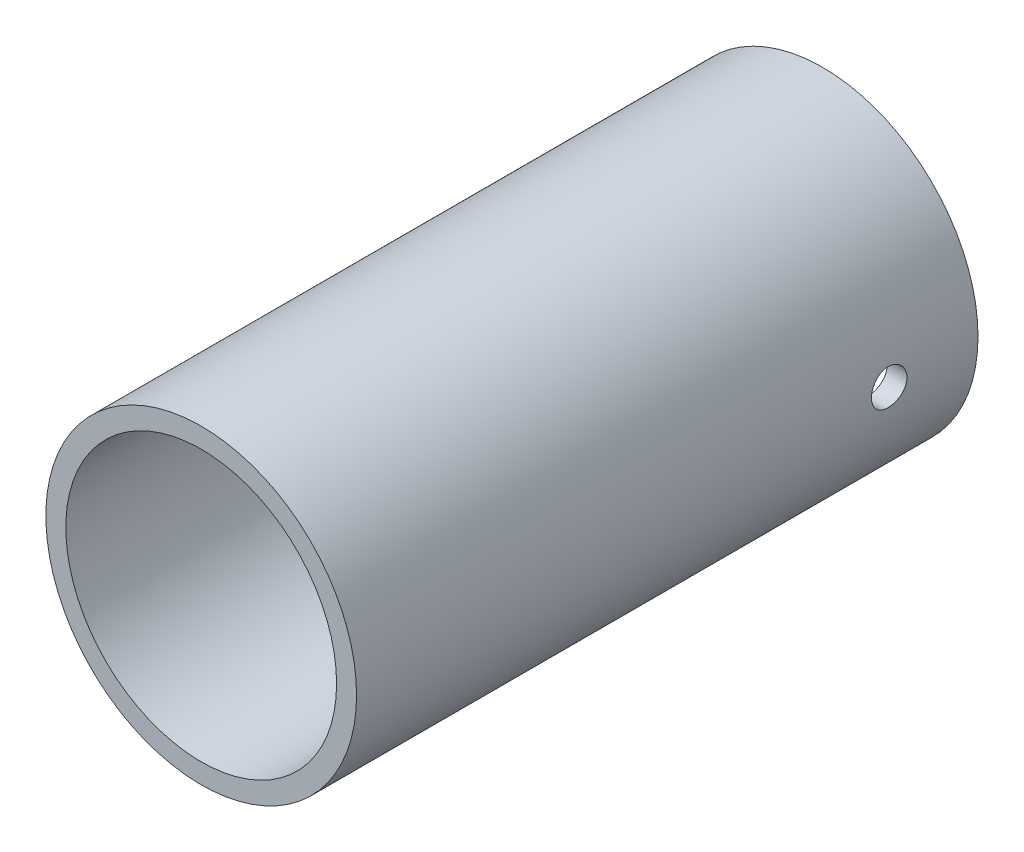
from build123d import *

# Parameters (mm, degrees)
BOSS_EXTRUDE1_DEPTH      = 7
BOSS_EXTRUDE1_DEPTH_BACK = 7
SKETCH3_R                = 3.5
SKETCH3_R_2              = 3.05
SKETCH4_R                = 0.4
CUT_EXTRUDE1_DEPTH       = 11.533399261


with BuildPart() as part:
    # Sketch3 → Boss-Extrude1 (new, two sides: drawn at the far end of the back side and taken through both)
    with BuildSketch(Plane.XY.offset(-BOSS_EXTRUDE1_DEPTH_BACK)):
        Circle(SKETCH3_R)
        Circle(SKETCH3_R_2, mode=Mode.SUBTRACT)
    extrude(amount=BOSS_EXTRUDE1_DEPTH + BOSS_EXTRUDE1_DEPTH_BACK)

    # Sketch4 → Cut-Extrude1 (cut, through all)
    with BuildSketch(Plane(origin=(3.55, 0, 0), x_dir=(0, 0, -1), z_dir=(1, 0, 0))):
        with Locations((5, 0)):
            Circle(SKETCH4_R)
    extrude(amount=-CUT_EXTRUDE1_DEPTH, mode=Mode.SUBTRACT)


solid = part.part
